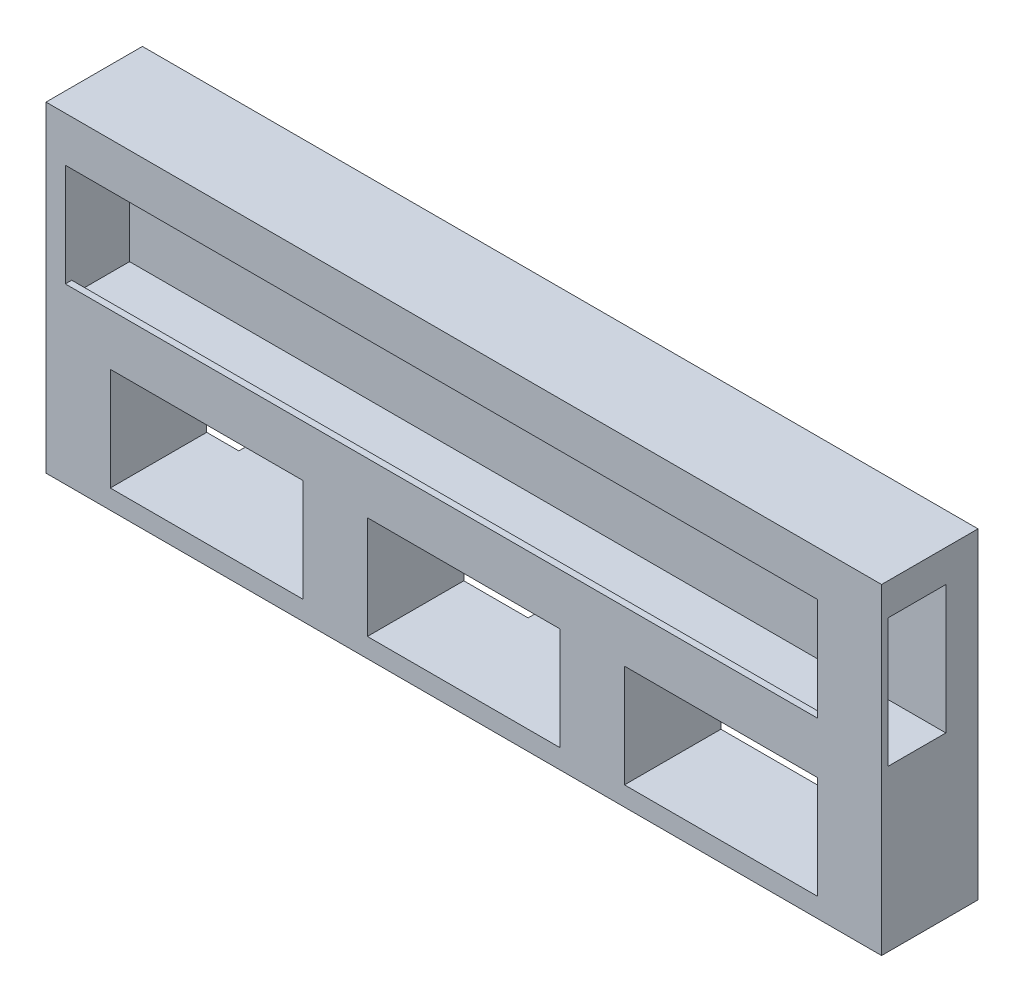
from build123d import *

# Parameters (mm, degrees)
SKETCH1_W               = 130
SKETCH1_H               = 50
BOSS_EXTRUDE1_DEPTH     = 15
CUT_EXTRUDE1_DEPTH      = 185.458667457
CUT_EXTRUDE1_DEPTH_BACK = 127
SKETCH4_W               = 10
SKETCH4_H               = 3
BOSS_EXTRUDE2_DEPTH     = 10
SKETCH6_W               = 30
SKETCH6_H               = 16
CUT_EXTRUDE2_DEPTH      = 253.419918463
SKETCH7_R               = 1.375
CUT_EXTRUDE3_DEPTH      = 222.415481023
SKETCH9_W               = 10
SKETCH9_H               = 3
BOSS_EXTRUDE4_DEPTH     = 10
SKETCH10_R              = 1.375
CUT_EXTRUDE4_DEPTH      = 10
SKETCH11_W              = 10
SKETCH11_H              = 1
BOSS_EXTRUDE5_DEPTH     = 20


with BuildPart() as part:
    # Sketch1 → Boss-Extrude1 (new body)
    with BuildSketch(Plane.XY):
        with Locations((-150.849056604, 105)):
            Rectangle(SKETCH1_W, SKETCH1_H)
    extrude(amount=BOSS_EXTRUDE1_DEPTH)

    # Sketch3 → Cut-Extrude1 (cut, two sides: drawn at the far end of the back side and taken through both)
    with BuildSketch(Plane(origin=(-85.849056604, 0, 0), x_dir=(0, 0, -1), z_dir=(1, 0, 0)).offset(-CUT_EXTRUDE1_DEPTH_BACK)):
        Polygon((-14, 125), (-5, 125), (-5, 105), (-14, 105), (-14, 107), (-15, 107), (-15, 123), (-14, 123), align=None)
    extrude(amount=CUT_EXTRUDE1_DEPTH + CUT_EXTRUDE1_DEPTH_BACK, mode=Mode.SUBTRACT)

    # Sketch4 → Boss-Extrude2 (add)
    with BuildSketch(Plane(origin=(0, 0, 0), x_dir=(-1, 0, 0), z_dir=(0, 0, -1))):
        with Locations((105.849056604, 81.5)):
            Rectangle(SKETCH4_W, SKETCH4_H)
        with Locations((195.849056604, 81.5)):
            Rectangle(SKETCH4_W, SKETCH4_H)
    extrude(amount=BOSS_EXTRUDE2_DEPTH)

    # Sketch6 → Cut-Extrude2 (cut, through all)
    with BuildSketch(Plane(origin=(0, 0, 0), x_dir=(-1, 0, 0), z_dir=(0, 0, -1))):
        with Locations((190.849056604, 91)):
            Rectangle(SKETCH6_W, SKETCH6_H)
        with Locations((150.849056604, 91)):
            Rectangle(SKETCH6_W, SKETCH6_H)
        with Locations((110.849056604, 91)):
            Rectangle(SKETCH6_W, SKETCH6_H)
    extrude(amount=-CUT_EXTRUDE2_DEPTH, mode=Mode.SUBTRACT)

    # Sketch7 → Cut-Extrude3 (cut, through all)
    with BuildSketch(Plane(origin=(0, 83, 0), x_dir=(1, 0, 0), z_dir=(0, 1, 0))):
        with Locations(Location((-105.849056604, 5, 0), (0, 0, 270))):
            Circle(SKETCH7_R)
    cut_extrude3 = extrude(amount=-CUT_EXTRUDE3_DEPTH, mode=Mode.SUBTRACT)

    # Mirror1: Cut-Extrude3 across plane
    add(cut_extrude3.mirror(Plane(origin=(-151, 0, 0), x_dir=(0, 0, 1), z_dir=(1, 0, 0))), mode=Mode.SUBTRACT)

    # Sketch9 → Boss-Extrude4 (add)
    with BuildSketch(Plane(origin=(0, 0, 0), x_dir=(-1, 0, 0), z_dir=(0, 0, -1))):
        with Locations((150.849056604, 81.5)):
            Rectangle(SKETCH9_W, SKETCH9_H)
    extrude(amount=BOSS_EXTRUDE4_DEPTH)

    # Sketch10 → Cut-Extrude4 (cut)
    with BuildSketch(Plane(origin=(0, 83, 0), x_dir=(1, 0, 0), z_dir=(0, 1, 0))):
        with Locations(Location((-150.849056604, 5, 0), (0, 0, 180))):
            Circle(SKETCH10_R)
    extrude(amount=-CUT_EXTRUDE4_DEPTH, mode=Mode.SUBTRACT)

    # Sketch11 → Boss-Extrude5 (add)
    with BuildSketch(Plane(origin=(0, 107, 0), x_dir=(1, 0, 0), z_dir=(0, 1, 0))):
        with Locations((-90.849056604, -14.5)):
            Rectangle(SKETCH11_W, SKETCH11_H)
    extrude(amount=BOSS_EXTRUDE5_DEPTH)


solid = part.part
